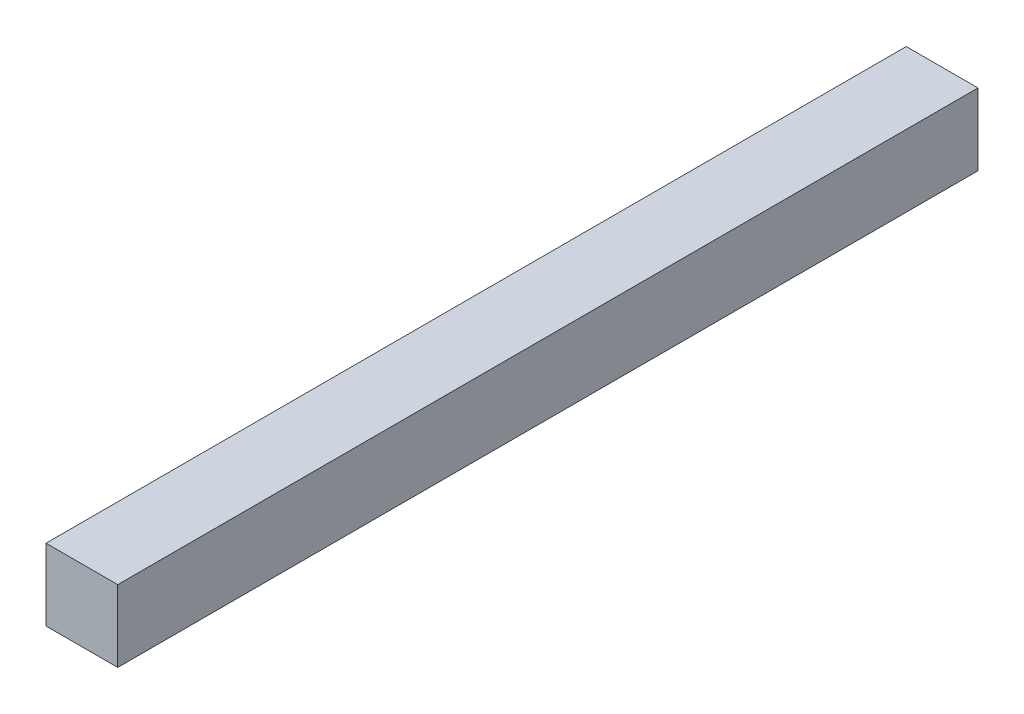
from build123d import *

# Parameters (mm, degrees)
SKETCH1_W           = 3.175
SKETCH1_H           = 3.175
BOSS_EXTRUDE1_DEPTH = 38.0746


with BuildPart() as part:
    # Sketch1 → Boss-Extrude1 (new body)
    with BuildSketch(Plane.XY):
        with Locations((1.5875, 1.5875)):
            Rectangle(SKETCH1_W, SKETCH1_H)
    extrude(amount=BOSS_EXTRUDE1_DEPTH)


solid = part.part
